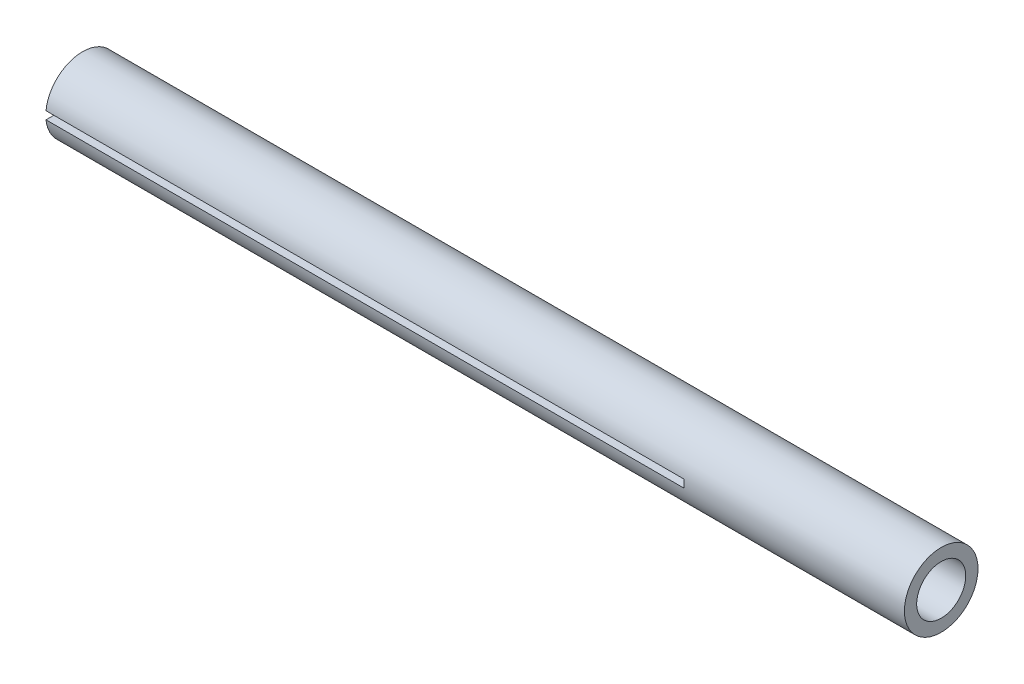
from build123d import *

# Parameters (mm, degrees)
SKETCH1_R               = 1.905
SKETCH1_R_2             = 1.27
BOSS_EXTRUDE1_DEPTH     = 44.45
CUT_EXTRUDE6_DEPTH      = 8.382
CUT_EXTRUDE6_DEPTH_BACK = 6.858


with BuildPart() as part:
    # Sketch1 → Boss-Extrude1 (new body)
    with BuildSketch(Plane(origin=(0, 0, 0), x_dir=(0, 0, -1), z_dir=(1, 0, 0))):
        with Locations((-37.290755903, 15.049483632)):
            Circle(SKETCH1_R)
        with Locations((-37.290755903, 15.049483632)):
            Circle(SKETCH1_R_2, mode=Mode.SUBTRACT)
    extrude(amount=BOSS_EXTRUDE1_DEPTH)

    # Sketch10 → Cut-Extrude6 (cut, two sides: drawn at the far end of the back side and taken through both)
    with BuildSketch(Plane.XY.offset(39.195755903).offset(-CUT_EXTRUDE6_DEPTH_BACK)):
        Polygon((0, 15.049483632), (0, 15.252683632), (33.032460862, 15.252683632), (33.032460862, 15.007269714), (33.032460862, 14.846283632), (0, 14.846283632), align=None)
    extrude(amount=CUT_EXTRUDE6_DEPTH + CUT_EXTRUDE6_DEPTH_BACK, mode=Mode.SUBTRACT)


solid = part.part
